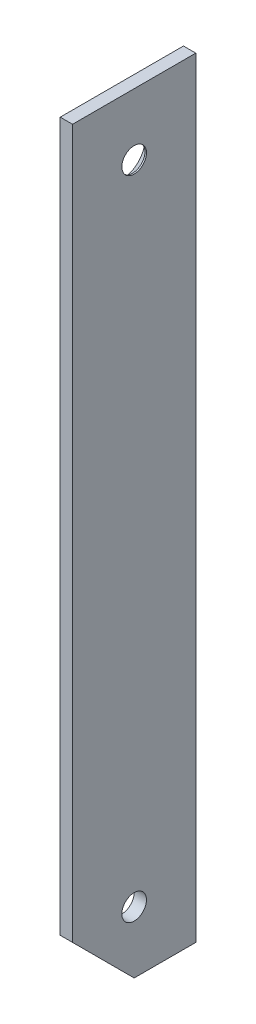
from build123d import *

# Parameters (mm, degrees)
SKETCH1_W           = 40
SKETCH1_H           = 250
SKETCH1_R           = 4
BOSS_EXTRUDE1_DEPTH = 4
CHAMFER1_SIZE       = 3.5
CHAMFER3_SIZE       = 20


with BuildPart() as part:
    # Sketch1 → Boss-Extrude1 (new body)
    with BuildSketch(Plane(origin=(0, 0, 0), x_dir=(0, 0, -1), z_dir=(1, 0, 0))):
        Rectangle(SKETCH1_W, SKETCH1_H)
        with Locations((0, 105)):
            Circle(SKETCH1_R, mode=Mode.SUBTRACT)
        with Locations((0, -105)):
            Circle(SKETCH1_R, mode=Mode.SUBTRACT)
    extrude(amount=BOSS_EXTRUDE1_DEPTH)

    # Chamfer1
    chamfer1_edges = [part.edges().sort_by_distance(p)[0] for p in [
        (0, 105, 4),
    ]]
    chamfer(chamfer1_edges, length=CHAMFER1_SIZE)

    # Chamfer3
    chamfer3_edges = [part.edges().sort_by_distance(p)[0] for p in [
        (2, -125, 20),
    ]]
    chamfer(chamfer3_edges, length=CHAMFER3_SIZE)


solid = part.part
